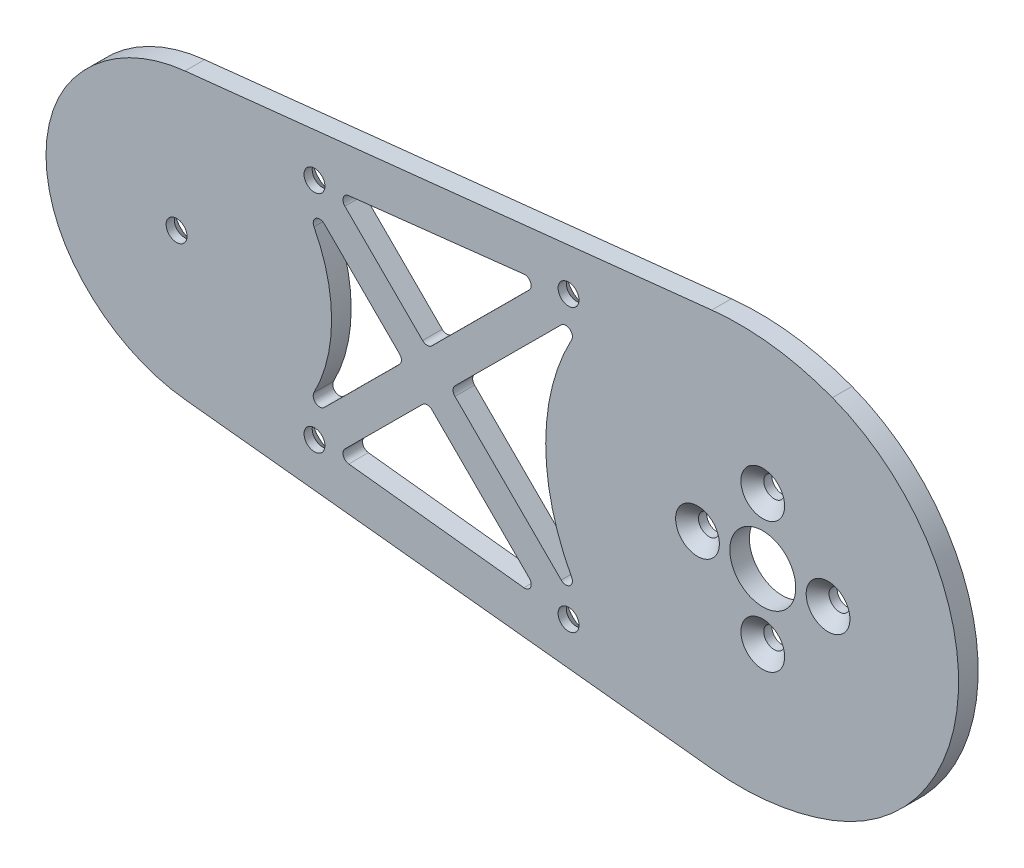
from build123d import *

# Parameters (mm, degrees)
SKETCH_1_R          = 1.6
SKETCH_1_R_2        = 5.05
EXTRUDE_1_DEPTH     = 3
SKETCH_2_R          = 1.6
CUT_EXTRUDE_1_DEPTH = 124.535581919
SKETCH_3_R          = 1.6
CUT_EXTRUDE_2_DEPTH = 124.535581919
FILLET_1_R          = 1
EXTRUDE_START       = -3
EXTRUDE_2_DEPTH     = 3
CHAMFER_1_SIZE      = 1.75
CHAMFER_2_SIZE      = 1.75


with BuildPart() as part:
    # ｽｹｯﾁ1 → ﾎﾞｽ - 押し出し1 (new body)
    with BuildSketch(Plane.XY):
        with BuildLine():
            Line((-2.227171492, 19.875605831), (86.459242762, 29.813408746))
            ThreePointArc((86.459242762, 29.813408746), (119.8, 0), (86.459242762, -29.813408746))
            Line((86.459242762, -29.813408746), (-2.227171492, -19.875605831))
            ThreePointArc((-2.227171492, -19.875605831), (-20, 0), (-2.227171492, 19.875605831))
        make_face()
        Circle(SKETCH_1_R, mode=Mode.SUBTRACT)
        with Locations((89.8, 0)):
            Circle(SKETCH_1_R_2, mode=Mode.SUBTRACT)
    extrude(amount=EXTRUDE_1_DEPTH)

    # ｽｹｯﾁ2 → ｶｯﾄ - 押し出し1 (cut, through all)
    with BuildSketch(Plane.XY.offset(3)):
        with Locations((89.8, 10)):
            Circle(SKETCH_2_R)
        with Locations((99.8, 0)):
            Circle(SKETCH_2_R)
        with Locations((89.8, -10)):
            Circle(SKETCH_2_R)
        with Locations((79.8, 0)):
            Circle(SKETCH_2_R)
    extrude(amount=-CUT_EXTRUDE_1_DEPTH, mode=Mode.SUBTRACT)

    # ｽｹｯﾁ3 → ｶｯﾄ - 押し出し2 (cut, through all)
    with BuildSketch(Plane.XY.offset(3)):
        with Locations((21.127828075, 17.209804787)):
            Circle(SKETCH_3_R)
        with Locations((21.127828075, -17.209804787)):
            Circle(SKETCH_3_R)
        with Locations((60.046685431, -21.570877871)):
            Circle(SKETCH_3_R)
        with Locations((60.046685431, 21.570877871)):
            Circle(SKETCH_3_R)
        Polygon((24.311632117, 17.566567628), (56.056085363, 21.123709076), (38.398951009, 3.529263334), align=None)
        Polygon((24.311632117, -17.566567628), (56.056085363, -21.123709076), (38.398951009, -3.529263334), align=None)
        with BuildLine():
            Line((22.640031329, 12.173707016), (34.857112989, 0))
            Line((34.857112989, 0), (22.640031329, -12.173707016))
            ThreePointArc((22.640031329, -12.173707016), (21.34147622, -12.270762122), (21.047953505, -11.002097675))
            ThreePointArc((21.047953505, -11.002097675), (23.75, 0), (21.047953505, 11.002097675))
            ThreePointArc((21.047953505, 11.002097675), (21.34147622, 12.270762122), (22.640031329, 12.173707016))
        make_face()
        with BuildLine():
            Line((58.927113914, 16.926017866), (41.940789029, 0))
            Line((41.940789029, 0), (58.927113914, -16.926017866))
            ThreePointArc((58.927113914, -16.926017866), (60.230336409, -17.019617306), (60.513751544, -15.744146574))
            ThreePointArc((60.513751544, -15.744146574), (56.55, 0), (60.513751544, 15.744146574))
            ThreePointArc((60.513751544, 15.744146574), (60.230336409, 17.019617306), (58.927113914, 16.926017866))
        make_face()
    extrude(amount=-CUT_EXTRUDE_2_DEPTH, mode=Mode.SUBTRACT)

    # ﾌｨﾚｯﾄ1
    fillet_1_edges = [part.edges().sort_by_distance(p)[0] for p in [
        (56.056085363, 21.123709076, 1.5),
        (38.398951009, 3.529263334, 1.5),
        (24.311632117, 17.566567628, 1.5),
        (41.940789029, 0, 1.5),
        (24.311632117, -17.566567628, 1.5),
        (38.398951009, -3.529263334, 1.5),
        (56.056085363, -21.123709076, 1.5),
        (34.857112989, 0, 1.5),
    ]]
    fillet(fillet_1_edges, radius=FILLET_1_R)

    # ｽｹｯﾁ4 → ﾎﾞｽ - 押し出し2 (add)
    with BuildSketch(Plane.XY.offset(3).offset(EXTRUDE_START)):
        with BuildLine():
            Line((81.98967358, 30.426942029), (1.294053754, 21.796225015))
            ThreePointArc((1.294053754, 21.796225015), (-8.232619041, 18.767269305), (-15.81095889, 12.248003061))
            ThreePointArc((-15.81095889, 12.248003061), (-9.792273379, 17.438789582), (-2.227171492, 19.875605831))
            Line((-2.227171492, 19.875605831), (86.459242762, 29.813408746))
            ThreePointArc((86.459242762, 29.813408746), (93.570181832, 29.762152626), (100.46928661, 28.038657657))
            ThreePointArc((100.46928661, 28.038657657), (91.370486749, 30.323854341), (81.98967358, 30.426942029))
        make_face()
        with BuildLine():
            ThreePointArc((-2.227171492, -19.875605831), (-9.792273379, -17.438789582), (-15.81095889, -12.248003061))
            ThreePointArc((-15.81095889, -12.248003061), (-8.232619041, -18.767269305), (1.294053754, -21.796225015))
            Line((1.294053754, -21.796225015), (81.98967358, -30.426942029))
            ThreePointArc((81.98967358, -30.426942029), (91.370486749, -30.323854341), (100.46928661, -28.038657657))
            ThreePointArc((100.46928661, -28.038657657), (93.570181832, -29.762152626), (86.459242762, -29.813408746))
            Line((86.459242762, -29.813408746), (-2.227171492, -19.875605831))
        make_face()
    extrude(amount=EXTRUDE_2_DEPTH)

    # 面取り1
    chamfer_1_edges = [part.edges().sort_by_distance(p)[0] for p in [
        (-1.6, 0, 0),
        (19.527828075, -17.209804787, 0),
        (58.446685431, -21.570877871, 0),
        (58.446685431, 21.570877871, 0),
        (19.527828075, 17.209804787, 0),
    ]]
    chamfer(chamfer_1_edges, length=CHAMFER_1_SIZE)

    # 面取り2
    chamfer_2_edges = [part.edges().sort_by_distance(p)[0] for p in [
        (88.2, 10, 3),
        (98.2, 0, 3),
        (88.2, -10, 3),
        (78.2, 0, 3),
    ]]
    chamfer(chamfer_2_edges, length=CHAMFER_2_SIZE)


solid = part.part
